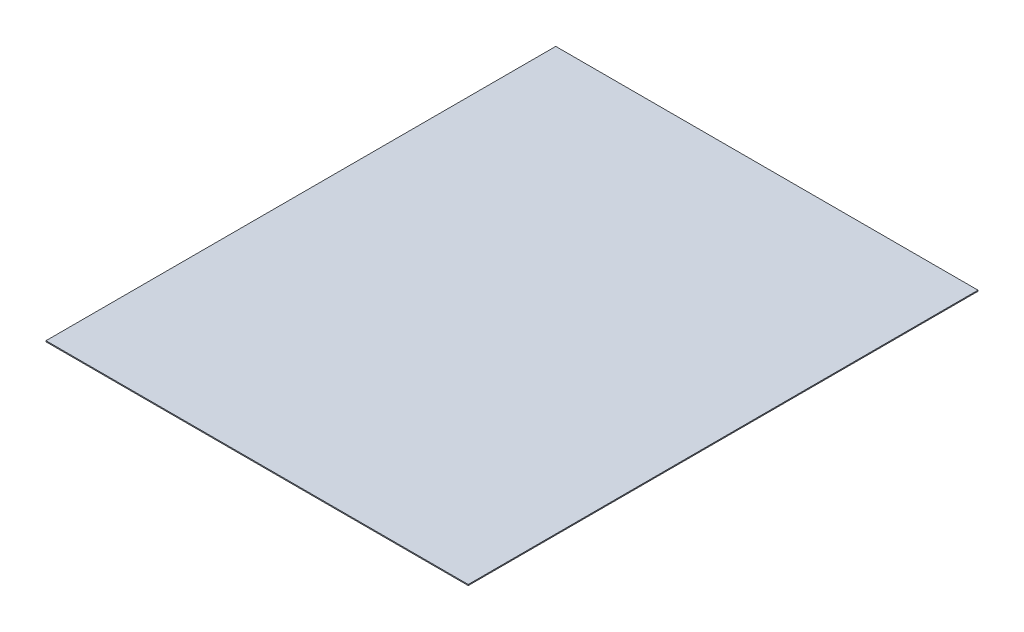
from build123d import *

# Parameters (mm, degrees)
SKETCH1_W                          = 627.5
SKETCH1_H                          = 1.5
STORE_KLAPE_KASET_KATI_RAF_1_DEPTH = 757.5


with BuildPart() as part:
    # Sketch1 → STORE_klape_kaset_kati_raf_1 (new body)
    with BuildSketch(Plane.XY):
        with Locations((376.25, 403.75)):
            Rectangle(SKETCH1_W, SKETCH1_H)
    extrude(amount=-STORE_KLAPE_KASET_KATI_RAF_1_DEPTH)


solid = part.part
